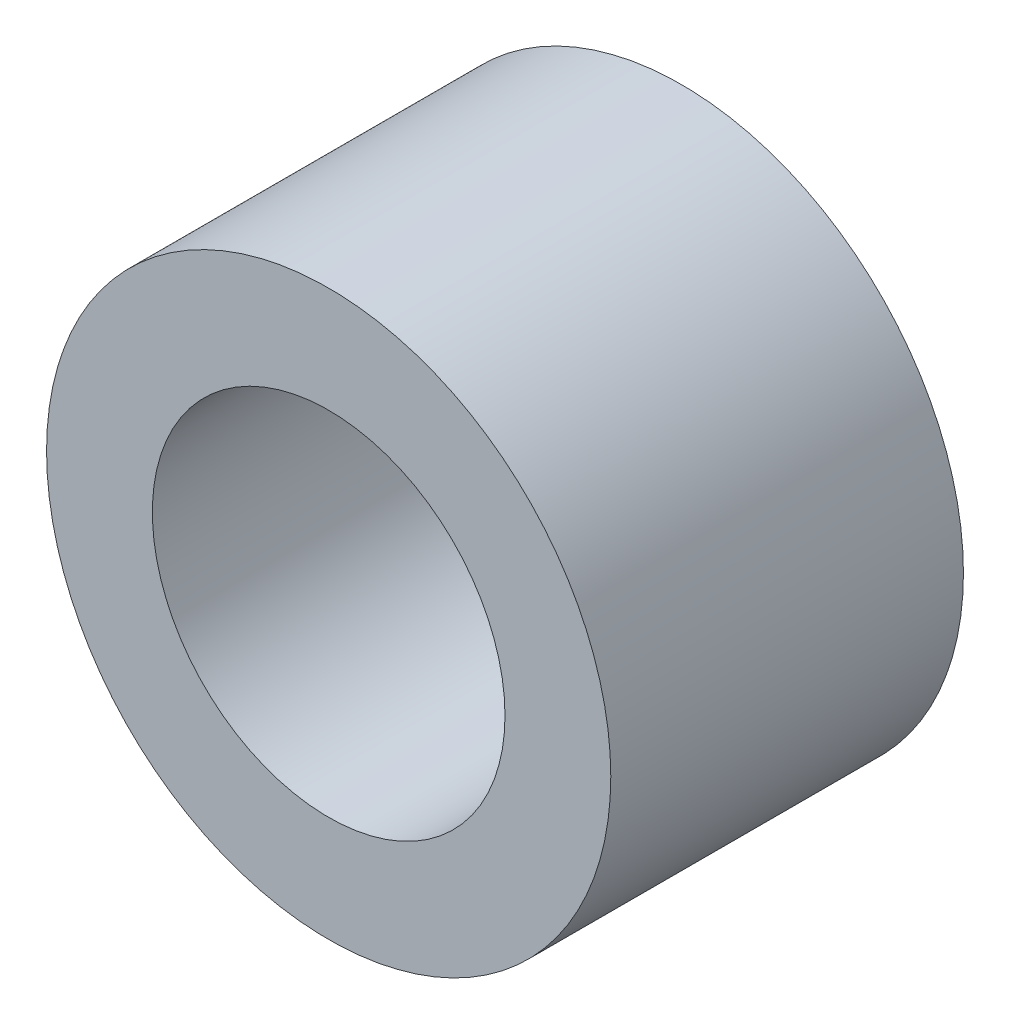
from build123d import *

# Parameters (mm, degrees)
SKETCH1_R           = 12.7
SKETCH1_R_2         = 7.9375
BOSS_EXTRUDE1_DEPTH = 7.9375


with BuildPart() as part:
    # Sketch1 → Boss-Extrude1 (new, symmetric)
    with BuildSketch(Plane.XY):
        Circle(SKETCH1_R)
        Circle(SKETCH1_R_2, mode=Mode.SUBTRACT)
    extrude(amount=BOSS_EXTRUDE1_DEPTH, both=True)


solid = part.part
